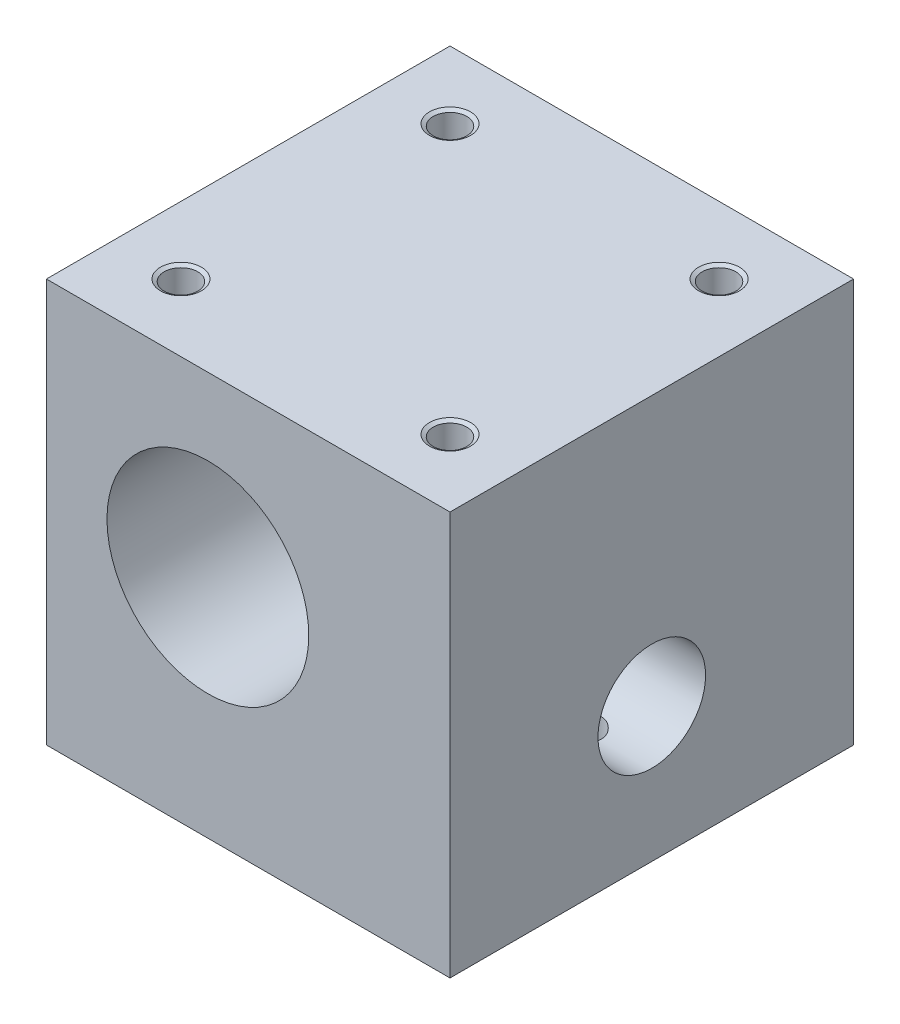
from build123d import *

# Parameters (mm, degrees)
SCHIZZO1_W                      = 30
SCHIZZO1_H                      = 30
SCHIZZO1_R                      = 7.5
ESTRUSIONE_ESTRUSIONE1_DEPTH    = 30
FORO_8_0_8_1_D                  = 8
FORO_8_0_8_1_DEPTH              = 10
FORO_8_0_8_1_TIP                = 2.403442476
FORO_FILETTATO_M3_1_AT_2_COUNT  = 2
FORO_FILETTATO_M3_1_AT_2_PITCH  = 20
FORO_FILETTATO_M3_2_D           = 2.5
FORO_FILETTATO_M3_2_DEPTH       = 8.5
FORO_FILETTATO_M3_2_CSINK_D     = 3.05
FORO_FILETTATO_M3_2_CSINK_ANGLE = 120
FORO_FILETTATO_M3_2_TIP         = 0.751075774


with BuildPart() as part:
    # Schizzo1 → Estrusione-Estrusione1 (new body)
    with BuildSketch(Plane.XY):
        with Locations((15, 15)):
            Rectangle(SCHIZZO1_W, SCHIZZO1_H)
        with Locations((12, 16.8)):
            Circle(SCHIZZO1_R, mode=Mode.SUBTRACT)
    extrude(amount=ESTRUSIONE_ESTRUSIONE1_DEPTH)

    # Foro Ø8.0 (8)-1
    with Locations(Plane(origin=(30, 0, 0), x_dir=(0, 0, -1), z_dir=(1, 0, 0))):
        with Locations((-15, 10)):
            Hole(FORO_8_0_8_1_D / 2, depth=FORO_8_0_8_1_DEPTH)
            with Locations((0, 0, -(FORO_8_0_8_1_DEPTH + FORO_8_0_8_1_TIP / 2))):  # 118° drill point
                Cone(0, FORO_8_0_8_1_D / 2, FORO_8_0_8_1_TIP, mode=Mode.SUBTRACT)

    # Schizzo7 → Foro filettato M3-1 (revolve, cut)
    with BuildSketch(Plane(origin=(5, 30, 25), x_dir=(0, 0, 1), z_dir=(1, 0, 0))):
        Polygon((0, 0), (0, 9.251075774), (1.25, 8.5), (1.25, 0.158771324), (1.525, 0), align=None)
    foro_filettato_m3_1 = revolve(axis=Axis((5, 36.35, 25), (0, -1, 0)), mode=Mode.SUBTRACT)

    # Foro filettato M3-1 at 2: Foro filettato M3-1 ×2
    with Locations(*[(i * FORO_FILETTATO_M3_1_AT_2_PITCH, 0, 0) for i in range(1, FORO_FILETTATO_M3_1_AT_2_COUNT)]):
        add(foro_filettato_m3_1, mode=Mode.SUBTRACT)

    # Specchia1: Foro filettato M3-1 across plane
    add(foro_filettato_m3_1.mirror(Plane.XY.offset(15)), mode=Mode.SUBTRACT)

    # Specchia1 copy 1 sketch → Specchia1 copy 1 (revolve, cut)
    with BuildSketch(Plane(origin=(25, 30, 5), x_dir=(0, 0, -1), z_dir=(1, 0, 0))):
        Polygon((0, 0), (0, -9.251075774), (1.25, -8.5), (1.25, -0.158771324), (1.525, 0), align=None)
    revolve(axis=Axis((25, 36.35, 5), (0, 1, 0)), mode=Mode.SUBTRACT)

    # Foro filettato M3-2
    with Locations(Plane(origin=(0, 0, 0), x_dir=(-1, 0, 0), z_dir=(0, -1, 0))):
        with Locations((-25, -15)):
            CounterSinkHole(FORO_FILETTATO_M3_2_D / 2, FORO_FILETTATO_M3_2_CSINK_D / 2, depth=FORO_FILETTATO_M3_2_DEPTH, counter_sink_angle=FORO_FILETTATO_M3_2_CSINK_ANGLE)
            with Locations((0, 0, -(FORO_FILETTATO_M3_2_DEPTH + FORO_FILETTATO_M3_2_TIP / 2))):  # 118° drill point
                Cone(0, FORO_FILETTATO_M3_2_D / 2, FORO_FILETTATO_M3_2_TIP, mode=Mode.SUBTRACT)


solid = part.part
